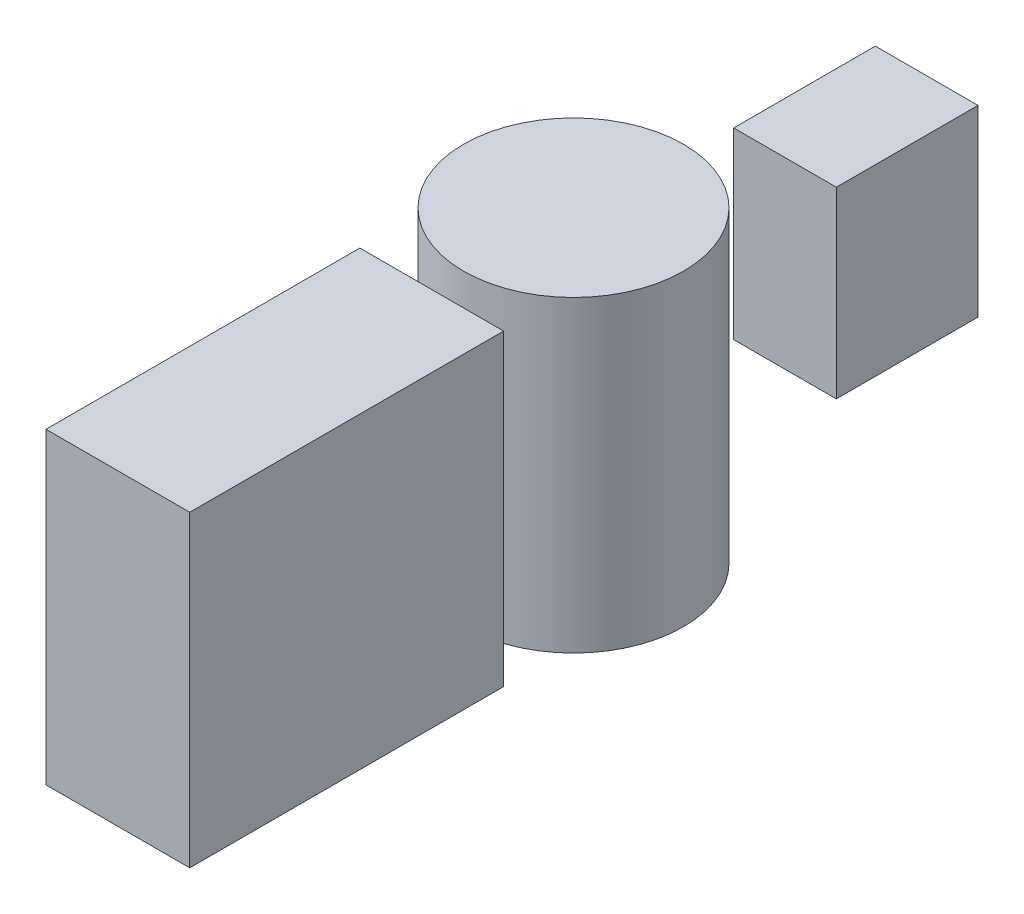
from build123d import *

# Parameters (mm, degrees)
SKETCH1_W             = 35.054568066
SKETCH1_H             = 45.364735144
BOSS_EXTRUDE1_DEPTH   = 12.7
SKETCH2_R             = 27.208020157
BOSS_EXTRUDE2_DEPTH   = 38.1
SKETCH2_W             = 35.562487798
SKETCH2_H             = 77.657804896
BOSS_EXTRUDE2_2_DEPTH = 38.1


with BuildPart() as part:
    # Sketch1 → Boss-Extrude1 (new, symmetric)
    with BuildSketch(Plane(origin=(0, 0, 0), x_dir=(0, 0, -1), z_dir=(1, 0, 0))):
        with Locations((69.851381954, 0)):
            Rectangle(SKETCH1_W, SKETCH1_H)
    extrude(amount=BOSS_EXTRUDE1_DEPTH, both=True)


with BuildPart() as body_2:
    # Sketch2 → Boss-Extrude2 (new, symmetric)
    with BuildSketch(Plane(origin=(0, 0, 0), x_dir=(1, 0, 0), z_dir=(0, 1, 0))):
        Circle(SKETCH2_R)
    extrude(amount=BOSS_EXTRUDE2_DEPTH, both=True)


with BuildPart() as body_3:
    # Sketch2 → Boss-Extrude2 2 (new, symmetric)
    with BuildSketch(Plane(origin=(0, 0, 0), x_dir=(1, 0, 0), z_dir=(0, 1, 0))):
        with Locations((0, -73.906657099)):
            Rectangle(SKETCH2_W, SKETCH2_H)
    extrude(amount=BOSS_EXTRUDE2_2_DEPTH, both=True)


solid = Compound([part.part, body_2.part, body_3.part])
